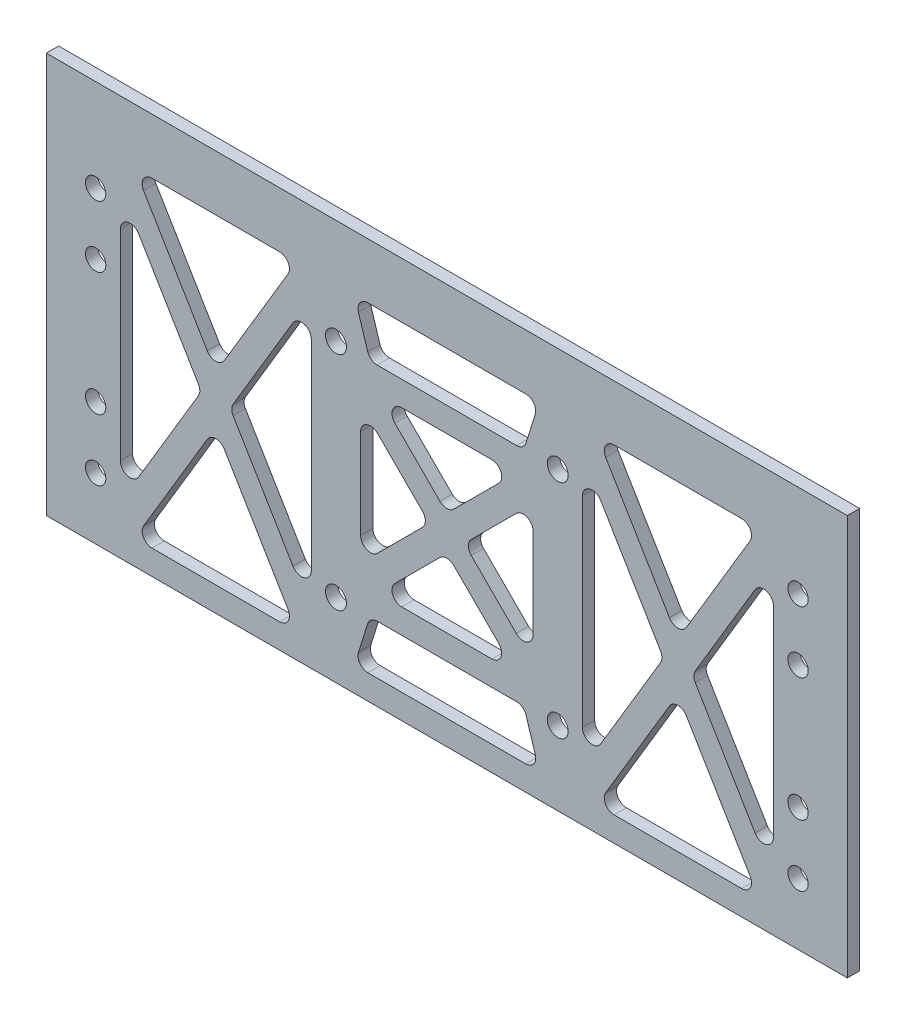
from build123d import *

# Parameters (mm, degrees)
SKETCH_1_W          = 130
SKETCH_1_H          = 60
EXTRUDE_1_DEPTH     = 2
SKETCH_2_R          = 1.65
CUT_EXTRUDE_1_DEPTH = 72.617037079
SKETCH_3_R          = 1.7
CUT_EXTRUDE_2_DEPTH = 72.617037079
SKETCH_4_W          = 31
SKETCH_4_H          = 52
SKETCH_4_W_2        = 28
SKETCH_4_H_2        = 28
CUT_EXTRUDE_4_DEPTH = 72.617037079
EXTRUDE_1_2_DEPTH   = 2
FILLET_1_R          = 1.6
SKETCH_6_W          = 130
SKETCH_6_H          = 2
EXTRUDE_2_DEPTH     = 5


with BuildPart() as part:
    # 草图1 → Extrude 1 (new body)
    with BuildSketch(Plane.XY):
        Rectangle(SKETCH_1_W, SKETCH_1_H)
    extrude(amount=EXTRUDE_1_DEPTH)

    # 草图2 → 切除-拉伸1 (cut, through all)
    with BuildSketch(Plane.XY.offset(2)):
        with Locations((-57, -10)):
            Circle(SKETCH_2_R)
        with Locations((-57, -20)):
            Circle(SKETCH_2_R)
        with Locations(Location((57, -10, 0), (0, 0, 180))):
            Circle(SKETCH_2_R)
        with Locations(Location((57, -20, 0), (0, 0, 180))):
            Circle(SKETCH_2_R)
        with Locations((57, 20)):
            Circle(SKETCH_2_R)
        with Locations((57, 10)):
            Circle(SKETCH_2_R)
        with Locations(Location((-57, 20, 0), (0, 0, 180))):
            Circle(SKETCH_2_R)
        with Locations(Location((-57, 10, 0), (0, 0, 180))):
            Circle(SKETCH_2_R)
    extrude(amount=-CUT_EXTRUDE_1_DEPTH, mode=Mode.SUBTRACT)

    # 草图3 → 切除-拉伸2 (cut, through all)
    with BuildSketch(Plane.XY.offset(2)):
        with Locations((-18, 18)):
            Circle(SKETCH_3_R)
        with Locations((-18, -18)):
            Circle(SKETCH_3_R)
        with Locations((18, 18)):
            Circle(SKETCH_3_R)
        with Locations((18, -18)):
            Circle(SKETCH_3_R)
    extrude(amount=-CUT_EXTRUDE_2_DEPTH, mode=Mode.SUBTRACT)

    # 草图4 → 切除-拉伸4 (cut, through all)
    with BuildSketch(Plane.XY.offset(2)):
        with Locations((-37.5, 0)):
            Rectangle(SKETCH_4_W, SKETCH_4_H)
        with Locations((37.5, 0)):
            Rectangle(SKETCH_4_W, SKETCH_4_H)
        Rectangle(SKETCH_4_W_2, SKETCH_4_H_2)
        Polygon((-15, 26), (-12.5, 18), (12.5, 18), (15, 26), align=None)
        Polygon((12.5, -18), (15, -26), (-15, -26), (-12.5, -18), align=None)
    extrude(amount=-CUT_EXTRUDE_4_DEPTH, mode=Mode.SUBTRACT)

    # 草图5 → Extrude 1 2 (add, through all)
    with BuildSketch(Plane.XY.offset(2)):
        Polygon((-54.717893948, 24.975870915), (-23.717893948, -27.024129085), (-20.282106052, -24.975870915), (-51.282106052, 27.024129085), align=None)
        Polygon((-23.717893948, 27.024129085), (-54.717893948, -24.975870915), (-51.282106052, -27.024129085), (-20.282106052, 24.975870915), align=None)
        Polygon((20.282106052, 24.975870915), (51.282106052, -27.024129085), (54.717893948, -24.975870915), (23.717893948, 27.024129085), align=None)
        Polygon((23.717893948, -27.024129085), (54.717893948, 24.975870915), (51.282106052, 27.024129085), (20.282106052, -24.975870915), align=None)
        Polygon((-15.414213562, 12.585786438), (12.585786438, -15.414213562), (15.414213562, -12.585786438), (-12.585786438, 15.414213562), align=None)
        Polygon((-12.585786438, -15.414213562), (15.414213562, 12.585786438), (12.585786438, 15.414213562), (-15.414213562, -12.585786438), align=None)
    extrude(amount=-EXTRUDE_1_2_DEPTH)

    # 圆角1
    fillet_1_edges = [part.edges().sort_by_distance(p)[0] for p in [
        (-12.5, -18, 1),
        (12.5, -18, 1),
        (15, -26, 1),
        (-15, -26, 1),
        (-15, 26, 1),
        (15, 26, 1),
        (12.5, 18, 1),
        (-12.5, 18, 1),
        (-53, -22.094242357, 1),
        (-53, 22.094242357, 1),
        (-50.671567559, -26, 1),
        (-24.328432441, -26, 1),
        (-22, 22.094242357, 1),
        (-22, -22.094242357, 1),
        (-24.328432441, 26, 1),
        (-50.671567559, 26, 1),
        (-37.5, 3.905757643, 1),
        (-35.171567559, 0, 1),
        (-37.5, -3.905757643, 1),
        (-39.828432441, 0, 1),
        (53, -22.094242357, 1),
        (53, 22.094242357, 1),
        (24.328432441, 26, 1),
        (50.671567559, 26, 1),
        (22, 22.094242357, 1),
        (22, -22.094242357, 1),
        (50.671567559, -26, 1),
        (24.328432441, -26, 1),
        (37.5, -3.905757643, 1),
        (35.171567559, 0, 1),
        (37.5, 3.905757643, 1),
        (39.828432441, 0, 1),
        (11.171572875, 14, 1),
        (-11.171572875, 14, 1),
        (-14, -11.171572875, 1),
        (-14, 11.171572875, 1),
        (-11.171572875, -14, 1),
        (11.171572875, -14, 1),
        (14, 11.171572875, 1),
        (14, -11.171572875, 1),
        (2.828427125, 0, 1),
        (0, -2.828427125, 1),
        (-2.828427125, 0, 1),
        (0, 2.828427125, 1),
    ]]
    fillet(fillet_1_edges, radius=FILLET_1_R)

    # 草图6 → 凸台-拉伸2 (add)
    with BuildSketch(Plane(origin=(0, 30, 0), x_dir=(1, 0, 0), z_dir=(0, 1, 0))):
        with Locations((0, -1)):
            Rectangle(SKETCH_6_W, SKETCH_6_H)
    extrude(amount=EXTRUDE_2_DEPTH)


solid = part.part
